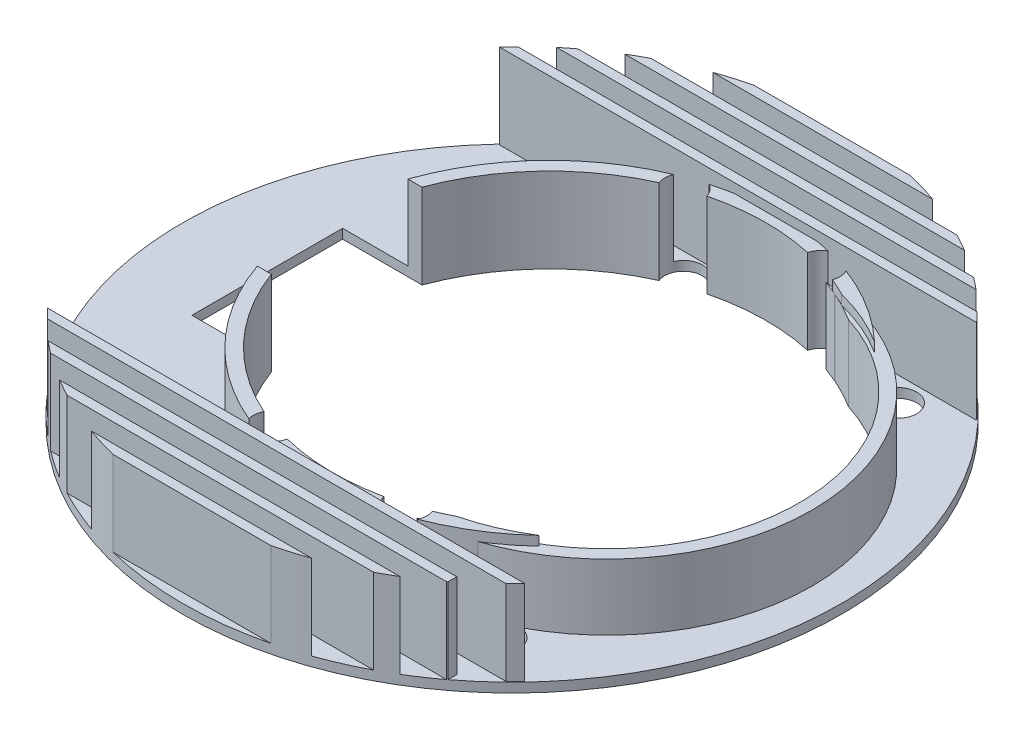
from build123d import *

# Parameters (mm, degrees)
SKETCH1_R                = 17.5
BOSS_EXTRUDE1_DEPTH      = 0.5
SKETCH2_R                = 11.5
CUT_EXTRUDE1_DEPTH       = 0.5
SKETCH3_W                = 15
SKETCH3_H                = 8
CUT_EXTRUDE4_DEPTH       = 2.5
BOSS_EXTRUDE6_DEPTH      = 4.5
BOSS_EXTRUDE7_START      = 4
SKETCH9_R                = 12.2
SKETCH9_R_2              = 11.5
BOSS_EXTRUDE7_DEPTH      = 4
SKETCH10_W               = 4.218070674
SKETCH10_H               = 8
CUT_EXTRUDE5_DEPTH       = 6
SKETCH11_R               = 1
SKETCH11_R_2             = 0.998714777
SKETCH11_R_3             = 0.998671431
SKETCH11_R_4             = 1.032567444
SKETCH11_R_5             = 1.008118798
CUT_EXTRUDE7_DEPTH       = 100
SKETCH12_R               = 10.530486407
CUT_EXTRUDE8_DEPTH       = 10
BOSS_EXTRUDE8_DEPTH      = 1
BOSS_EXTRUDE8_DEPTH_BACK = 4
SKETCH13_R               = 10.877782244
SKETCH13_R_2             = 10.206062314
SKETCH15_R               = 24.190565002
CUT_EXTRUDE9_DEPTH       = 1
CUT_EXTRUDE10_START      = -10
SKETCH16_R               = 11.5
CUT_EXTRUDE10_DEPTH      = 10


with BuildPart() as part:
    # Sketch1 → Boss-Extrude1 (new body)
    with BuildSketch(Plane(origin=(0, 0, 0), x_dir=(1, 0, 0), z_dir=(0, 1, 0))):
        with Locations(Location((0, 0, 0), (0, 0, 270))):
            Circle(SKETCH1_R)
    extrude(amount=BOSS_EXTRUDE1_DEPTH)

    # Sketch2 → Cut-Extrude1 (cut)
    with BuildSketch(Plane(origin=(0, 0.5, 0), x_dir=(1, 0, 0), z_dir=(0, 1, 0))):
        with Locations(Location((2, 0, 0), (0, 0, 270))):
            Circle(SKETCH2_R)
    extrude(amount=-CUT_EXTRUDE1_DEPTH, mode=Mode.SUBTRACT)

    # Sketch3 → Cut-Extrude4 (cut)
    with BuildSketch(Plane(origin=(0, 0, 0), x_dir=(1, 0, 0), z_dir=(0, 1, 0))):
        with Locations((-5.5, 0)):
            Rectangle(SKETCH3_W, SKETCH3_H)
    extrude(amount=CUT_EXTRUDE4_DEPTH, mode=Mode.SUBTRACT)

    # Sketch7 → Boss-Extrude6 (add)
    with BuildSketch(Plane(origin=(0, 0.5, 0), x_dir=(1, 0, 0), z_dir=(0, 1, 0))):
        with BuildLine():
            Line((-11.135528726, 13.5), (11.135528726, 13.5))
            ThreePointArc((11.135528726, 13.5), (10.820652744, 13.753671299), (10.5, 14))
            Line((10.5, 14), (-10.5, 14))
            ThreePointArc((-10.5, 14), (-10.820652744, 13.753671299), (-11.135528726, 13.5))
        make_face()
        with BuildLine():
            Line((12.176537068, 12.5), (-12.176537068, 12.5))
            ThreePointArc((-12.176537068, 12.5), (-12.42556977, 12.252480192), (-12.669572012, 12))
            Line((-12.669572012, 12), (12.669572012, 12))
            ThreePointArc((12.669572012, 12), (12.42556977, 12.252480192), (12.176537068, 12.5))
        make_face()
        with BuildLine():
            ThreePointArc((-11.145229996, -13.491992008), (-10.830835088, -13.74565427), (-10.510668849, -13.991992008))
            Line((-10.510668849, -13.991992008), (10.510668849, -13.991992008))
            ThreePointArc((10.510668849, -13.991992008), (10.53333572, -13.974936086), (10.555974914, -13.957843444))
            Line((10.555974914, -13.957843444), (10.555974914, -13.491992008))
            Line((10.555974914, -13.491992008), (-11.145229996, -13.491992008))
        make_face()
        with BuildLine():
            Line((-9.013878189, 15), (9.013878189, 15))
            ThreePointArc((9.013878189, 15), (8.572604405, 15.256488905), (8.124038405, 15.5))
            Line((8.124038405, 15.5), (-8.124038405, 15.5))
            ThreePointArc((-8.124038405, 15.5), (-8.572604405, 15.256488905), (-9.013878189, 15))
        make_face()
        with BuildLine():
            ThreePointArc((-9.027190906, -14.991992008), (-8.586884855, -15.248455938), (-8.139298719, -15.491992008))
            Line((-8.139298719, -15.491992008), (8.139298719, -15.491992008))
            ThreePointArc((8.139298719, -15.491992008), (8.586884855, -15.248455938), (9.027190906, -14.991992008))
            Line((9.027190906, -14.991992008), (-9.027190906, -14.991992008))
        make_face()
        with BuildLine():
            Line((-5.830951895, 16.5), (5.830951895, 16.5))
            ThreePointArc((5.830951895, 16.5), (4.998387844, 16.770990399), (4.153311931, 17))
            Line((4.153311931, 17), (-4.153311931, 17))
            ThreePointArc((-4.153311931, 17), (-4.998387844, 16.770990399), (-5.830951895, 16.5))
        make_face()
        with BuildLine():
            Line((5.853562985, -16.491992008), (-5.853562985, -16.491992008))
            ThreePointArc((-5.853562985, -16.491992008), (-5.025979841, -16.762742217), (-4.185953609, -16.991992008))
            Line((-4.185953609, -16.991992008), (4.185953609, -16.991992008))
            ThreePointArc((4.185953609, -16.991992008), (5.025979841, -16.762742217), (5.853562985, -16.491992008))
        make_face()
        with BuildLine():
            Line((12.669572012, -12), (-12.669572012, -12))
            ThreePointArc((-12.669572012, -12), (-12.42556977, -12.252480192), (-12.176537068, -12.5))
            Line((-12.176537068, -12.5), (12.176537068, -12.5))
            ThreePointArc((12.176537068, -12.5), (12.42556977, -12.252480192), (12.669572012, -12))
        make_face()
    extrude(amount=BOSS_EXTRUDE6_DEPTH)

    # Sketch9 → Boss-Extrude7 (add)
    with BuildSketch(Plane(origin=(0, 0.5, 0), x_dir=(1, 0, 0), z_dir=(0, 1, 0)).offset(BOSS_EXTRUDE7_START)):
        with Locations((2, 0)):
            Circle(SKETCH9_R)
        with Locations(Location((2, 0, 0), (0, 0, 270))):
            Circle(SKETCH9_R_2, mode=Mode.SUBTRACT)
    extrude(amount=-BOSS_EXTRUDE7_DEPTH)

    # Sketch10 → Cut-Extrude5 (cut)
    with BuildSketch(Plane.XZ):
        with Locations((-10.890964663, 0)):
            Rectangle(SKETCH10_W, SKETCH10_H)
    extrude(amount=-CUT_EXTRUDE5_DEPTH, mode=Mode.SUBTRACT)

    # Sketch11 → Cut-Extrude7 (cut)
    with BuildSketch(Plane.XZ):
        with Locations(Location((-7.340296828, -10.142549821, 0), (0, 0, 270))):
            Circle(SKETCH11_R)
        with Locations((-1.767569388, -10.865331146)):
            Circle(SKETCH11_R_2)
        with Locations((5.429630438, -10.976685978)):
            Circle(SKETCH11_R_3)
        with Locations(Location((-7.340296828, 9.917402438, 0), (0, 0, 270))):
            Circle(SKETCH11_R)
        with Locations((5.429630438, 10.976685978)):
            Circle(SKETCH11_R_4)
        with Locations((-1.767569388, 10.976685978)):
            Circle(SKETCH11_R)
        with Locations(Location((10.013638897, 10.643798729, 0), (0, 0, 270))):
            Circle(SKETCH11_R_5)
        with Locations(Location((9.772353005, -10.712194768, 0), (0, 0, 270))):
            Circle(SKETCH11_R)
    extrude(amount=-CUT_EXTRUDE7_DEPTH, mode=Mode.SUBTRACT)

    # Sketch12 → Cut-Extrude8 (cut)
    with BuildSketch(Plane.XZ):
        with Locations((4.720351271, 0)):
            Circle(SKETCH12_R)
    extrude(amount=-CUT_EXTRUDE8_DEPTH, mode=Mode.SUBTRACT)


with BuildPart() as body_2:
    # Sketch13 → Boss-Extrude8 (new, two sides: drawn at the far end of the back side and taken through both)
    with BuildSketch(Plane(origin=(0, 0, 0), x_dir=(-1, 0, 0), z_dir=(0, -1, 0)).offset(-BOSS_EXTRUDE8_DEPTH_BACK)):
        with Locations(Location((-5.044775364, 0, 0), (0, 0, 90))):
            Circle(SKETCH13_R)
        with Locations(Location((-5.044775364, 0, 0), (0, 0, 90))):
            Circle(SKETCH13_R_2, mode=Mode.SUBTRACT)
    extrude(amount=BOSS_EXTRUDE8_DEPTH + BOSS_EXTRUDE8_DEPTH_BACK)

    # Sketch15 → Cut-Extrude9 (cut)
    with BuildSketch(Plane.XZ.offset(1)):
        Circle(SKETCH15_R)
    extrude(amount=-CUT_EXTRUDE9_DEPTH, mode=Mode.SUBTRACT)

    # Sketch16 → Cut-Extrude10 (cut)
    with BuildSketch(Plane.XZ.offset(CUT_EXTRUDE10_START)):
        with Locations((2, 0)):
            Circle(SKETCH16_R)
    extrude(amount=CUT_EXTRUDE10_DEPTH, mode=Mode.SUBTRACT)


solid = Compound([part.part, body_2.part])
